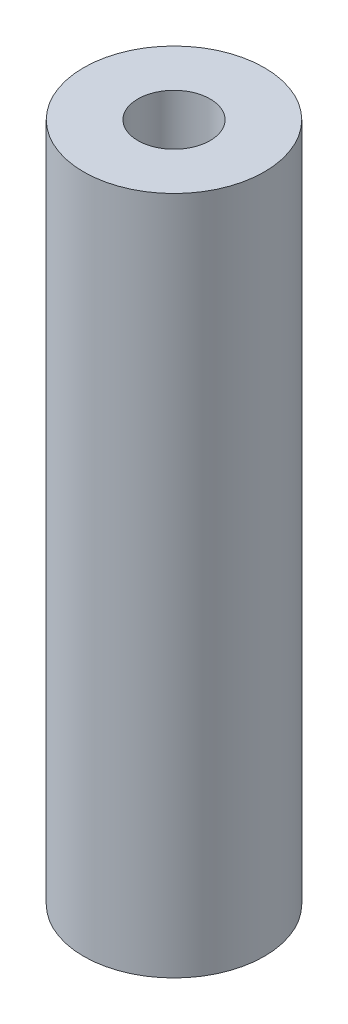
from build123d import *

# Parameters (mm, degrees)
SKETCH_1_R      = 2.5
SKETCH_1_R_2    = 1
EXTRUDE_1_DEPTH = 18.8


with BuildPart() as part:
    # 草图1 → 凸台-拉伸1 (new body)
    with BuildSketch(Plane(origin=(0, 0, 0), x_dir=(1, 0, 0), z_dir=(0, 1, 0))):
        with Locations(Location((0, 0, 0), (0, 0, 270))):
            Circle(SKETCH_1_R)
        with Locations(Location((0, 0, 0), (0, 0, 270))):
            Circle(SKETCH_1_R_2, mode=Mode.SUBTRACT)
    extrude(amount=EXTRUDE_1_DEPTH)


solid = part.part
